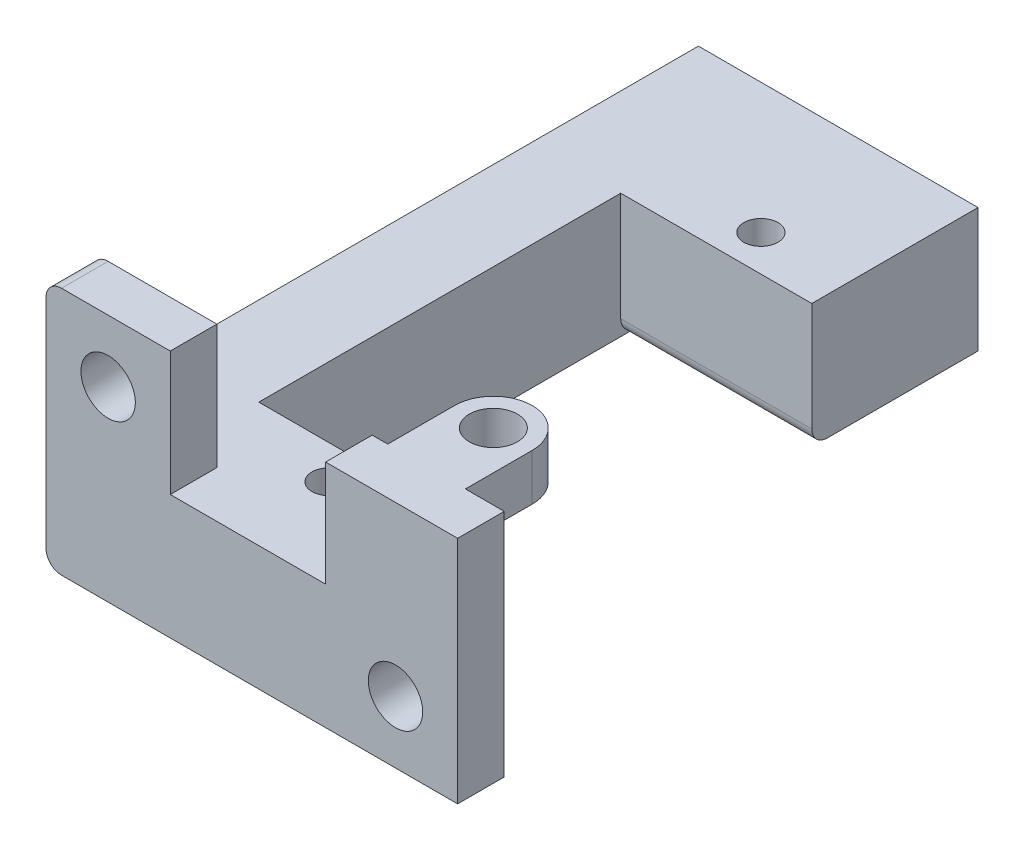
from build123d import *

# Parameters (mm, degrees)
EXTRUDE_1_DEPTH      = 4
EXTRUDE_2_DEPTH      = 2
EXTRUDE_2_DEPTH_BACK = 1
SKETCH_4_R           = 1.55
EXTRUDE_3_DEPTH      = 3
SKETCH_5_W           = 11
SKETCH_5_H           = 6.81
EXTRUDE_4_DEPTH      = 3
SKETCH_6_R           = 1.75
CUT_EXTRUDE_1_DEPTH  = 3
SKETCH_7_W           = 2.5
SKETCH_7_H           = 14.81
CUT_EXTRUDE_2_DEPTH  = 46.44227107
FILLET_1_R           = 1
FILLET_2_R           = 1
SKETCH_8_R           = 1.1
CUT_EXTRUDE_3_DEPTH  = 33.345787979


with BuildPart() as part:
    # 草图1 → 凸台-拉伸1 (new, symmetric)
    with BuildSketch(Plane(origin=(0, 0, 0), x_dir=(1, 0, 0), z_dir=(0, 1, 0))):
        Polygon((-9, 20), (-9, -20), (9, -20), (9, -14), (-3.3, -14), (-3.3, 9.3), (9, 9.3), (9, 20), align=None)
    extrude(amount=EXTRUDE_1_DEPTH, both=True)

    # 草图3 → 凸台-拉伸2 (add, two sides: drawn at the far end of the back side and taken through both)
    with BuildSketch(Plane.XY.offset(20).offset(-EXTRUDE_2_DEPTH_BACK)):
        Polygon((-1, 4), (20, 4), (20, -4), (-9, -4), (-9, 12), (-1, 12), align=None)
    extrude(amount=EXTRUDE_2_DEPTH + EXTRUDE_2_DEPTH_BACK)



with BuildPart() as body_2:
    # 草图4 → 凸台-拉伸3 (new body)
    with BuildSketch(Plane(origin=(0, 7.81, 0), x_dir=(1, 0, 0), z_dir=(0, 1, 0))):
        with BuildLine():
            Line((10, -14.7), (10, -22))
            Line((10, -22), (15, -22))
            Line((15, -22), (15, -14.7))
            ThreePointArc((15, -14.7), (12.5, -12.2), (10, -14.7))
        make_face()
        with Locations(Location((12.5, -14.7, 0), (0, 0, 270))):
            Circle(SKETCH_4_R, mode=Mode.SUBTRACT)
    extrude(amount=EXTRUDE_3_DEPTH)


with BuildPart() as part_1:
    add(part.part)

    add(body_2.part)  # 凸台-拉伸4 merges body 2
    # 草图5 → 凸台-拉伸4 (add)
    with BuildSketch(Plane(origin=(0, 0, 19), x_dir=(-1, 0, 0), z_dir=(0, 0, -1))):
        with Locations((-14.5, 7.405)):
            Rectangle(SKETCH_5_W, SKETCH_5_H)
    extrude(amount=-EXTRUDE_4_DEPTH)

    # 草图6 → 切除-拉伸1 (cut)
    with BuildSketch(Plane(origin=(0, 0, 19), x_dir=(-1, 0, 0), z_dir=(0, 0, -1))):
        with Locations((-13.5, 0)):
            Circle(SKETCH_6_R)
        with Locations((5, 8)):
            Circle(SKETCH_6_R)
    extrude(amount=-CUT_EXTRUDE_1_DEPTH, mode=Mode.SUBTRACT)

    # 草图7 → 切除-拉伸2 (cut, through all)
    with BuildSketch(Plane(origin=(0, 0, 19), x_dir=(-1, 0, 0), z_dir=(0, 0, -1))):
        with Locations((-18.75, 3.405)):
            Rectangle(SKETCH_7_W, SKETCH_7_H)
    extrude(amount=-CUT_EXTRUDE_2_DEPTH, mode=Mode.SUBTRACT)

    # 圆角1
    fillet_1_edges = [part_1.edges().sort_by_distance(p)[0] for p in [
        (-9, -4, 1),
        (-9, 12, 20.5),
    ]]
    fillet(fillet_1_edges, radius=FILLET_1_R)

    # 圆角2
    fillet_2_edges = [part_1.edges().sort_by_distance(p)[0] for p in [
        (2.85, -4, -9.3),
        (2.85, -4, 14),
    ]]
    fillet(fillet_2_edges, radius=FILLET_2_R)

    # 草图8 → 切除-拉伸3 (cut, through all)
    with BuildSketch(Plane.XZ.offset(4)):
        with Locations(Location((3.4, -11.623058817, 0), (0, 0, 270))):
            Circle(SKETCH_8_R)
        with Locations(Location((3.4, 16.176941183, 0), (0, 0, 270))):
            Circle(SKETCH_8_R)
    extrude(amount=-CUT_EXTRUDE_3_DEPTH, mode=Mode.SUBTRACT)


solid = part_1.part
